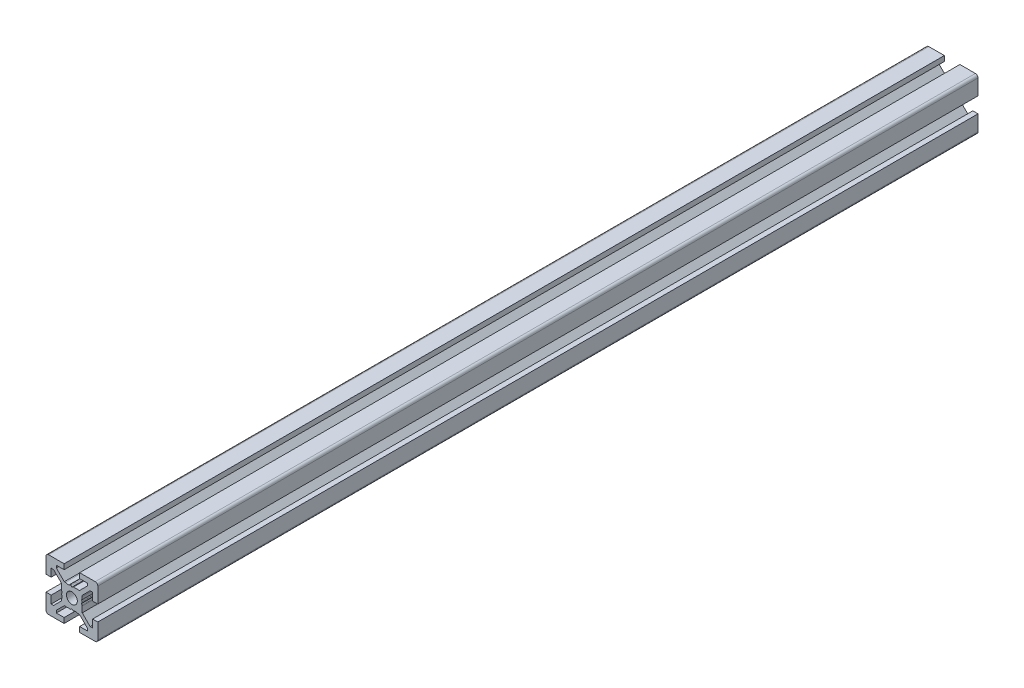
from build123d import *

# Parameters (mm, degrees)
SKETCH1_R           = 2.1
BOSS_EXTRUDE1_DEPTH = 340


with BuildPart() as part:
    # Sketch1 → Boss-Extrude1 (new body)
    with BuildSketch(Plane(origin=(0, 0, -2000), x_dir=(-1, 0, 0), z_dir=(0, 0, -1))):
        with BuildLine():
            Line((10, -3), (8, -3))
            Line((8, -3), (8, -6))
            Line((8, -6), (7.060660172, -6))
            Line((7.060660172, -6), (4, -2.939339828))
            Line((4, -2.939339828), (4, -2.5))
            Line((4, -2.5), (3.750976592, -1.218885629))
            Line((3.750976592, -1.218885629), (3.933012702, -0.903589838))
            ThreePointArc((3.933012702, -0.903589838), (4, -0.653589838), (3.933012702, -0.403589838))
            Line((3.933012702, -0.403589838), (3.7, 0))
            Line((3.7, 0), (3.933012702, 0.403589838))
            ThreePointArc((3.933012702, 0.403589838), (3.982962913, 0.524180316), (4, 0.653589838))
            Line((4, 0.653589838), (4, 2.939339828))
            Line((4, 2.939339828), (7.060660172, 6))
            Line((7.060660172, 6), (8, 6))
            Line((8, 6), (8, 3))
            Line((8, 3), (10, 3))
            Line((10, 3), (10, 9))
            ThreePointArc((10, 9), (9.707106781, 9.707106781), (9, 10))
            Line((9, 10), (3, 10))
            Line((3, 10), (3, 8))
            Line((3, 8), (6, 8))
            Line((6, 8), (6, 7.060660172))
            Line((6, 7.060660172), (2.939339828, 4))
            Line((2.939339828, 4), (2.5, 4))
            Line((2.5, 4), (1.218885629, 3.750976592))
            Line((1.218885629, 3.750976592), (0.903589838, 3.933012702))
            ThreePointArc((0.903589838, 3.933012702), (0.653589838, 4), (0.403589838, 3.933012702))
            Line((0.403589838, 3.933012702), (0, 3.7))
            Line((0, 3.7), (-0.403589838, 3.933012702))
            ThreePointArc((-0.403589838, 3.933012702), (-0.524180316, 3.982962913), (-0.653589838, 4))
            Line((-0.653589838, 4), (-2.939339828, 4))
            Line((-2.939339828, 4), (-6, 7.060660172))
            Line((-6, 7.060660172), (-6, 8))
            Line((-6, 8), (-3, 8))
            Line((-3, 8), (-3, 10))
            Line((-3, 10), (-9, 10))
            ThreePointArc((-9, 10), (-9.707106781, 9.707106781), (-10, 9))
            Line((-10, 9), (-10, 3))
            Line((-10, 3), (-8, 3))
            Line((-8, 3), (-8, 6))
            Line((-8, 6), (-7.060660172, 6))
            Line((-7.060660172, 6), (-4, 2.939339828))
            Line((-4, 2.939339828), (-4, 2.5))
            Line((-4, 2.5), (-3.750976592, 1.218885629))
            Line((-3.750976592, 1.218885629), (-3.933012702, 0.903589838))
            ThreePointArc((-3.933012702, 0.903589838), (-4, 0.653589838), (-3.933012702, 0.403589838))
            Line((-3.933012702, 0.403589838), (-3.7, 0))
            Line((-3.7, 0), (-3.933012702, -0.403589838))
            ThreePointArc((-3.933012702, -0.403589838), (-3.982962913, -0.524180316), (-4, -0.653589838))
            Line((-4, -0.653589838), (-4, -2.939339828))
            Line((-4, -2.939339828), (-7.060660172, -6))
            Line((-7.060660172, -6), (-8, -6))
            Line((-8, -6), (-8, -3))
            Line((-8, -3), (-10, -3))
            Line((-10, -3), (-10, -9))
            ThreePointArc((-10, -9), (-9.707106781, -9.707106781), (-9, -10))
            Line((-9, -10), (-3, -10))
            Line((-3, -10), (-3, -8))
            Line((-3, -8), (-6, -8))
            Line((-6, -8), (-6, -7.060660172))
            Line((-6, -7.060660172), (-2.939339828, -4))
            Line((-2.939339828, -4), (-2.5, -4))
            Line((-2.5, -4), (-1.218885629, -3.750976592))
            Line((-1.218885629, -3.750976592), (-0.903589838, -3.933012702))
            ThreePointArc((-0.903589838, -3.933012702), (-0.653589838, -4), (-0.403589838, -3.933012702))
            Line((-0.403589838, -3.933012702), (0, -3.7))
            Line((0, -3.7), (0.403589838, -3.933012702))
            ThreePointArc((0.403589838, -3.933012702), (0.524180316, -3.982962913), (0.653589838, -4))
            Line((0.653589838, -4), (2.939339828, -4))
            Line((2.939339828, -4), (6, -7.060660172))
            Line((6, -7.060660172), (6, -8))
            Line((6, -8), (3, -8))
            Line((3, -8), (3, -10))
            Line((3, -10), (9, -10))
            ThreePointArc((9, -10), (9.707106781, -9.707106781), (10, -9))
            Line((10, -9), (10, -3))
        make_face()
        with Locations(Location((0, 0, 0), (0, 0, 180))):
            Circle(SKETCH1_R, mode=Mode.SUBTRACT)
    extrude(amount=-BOSS_EXTRUDE1_DEPTH)


solid = part.part
